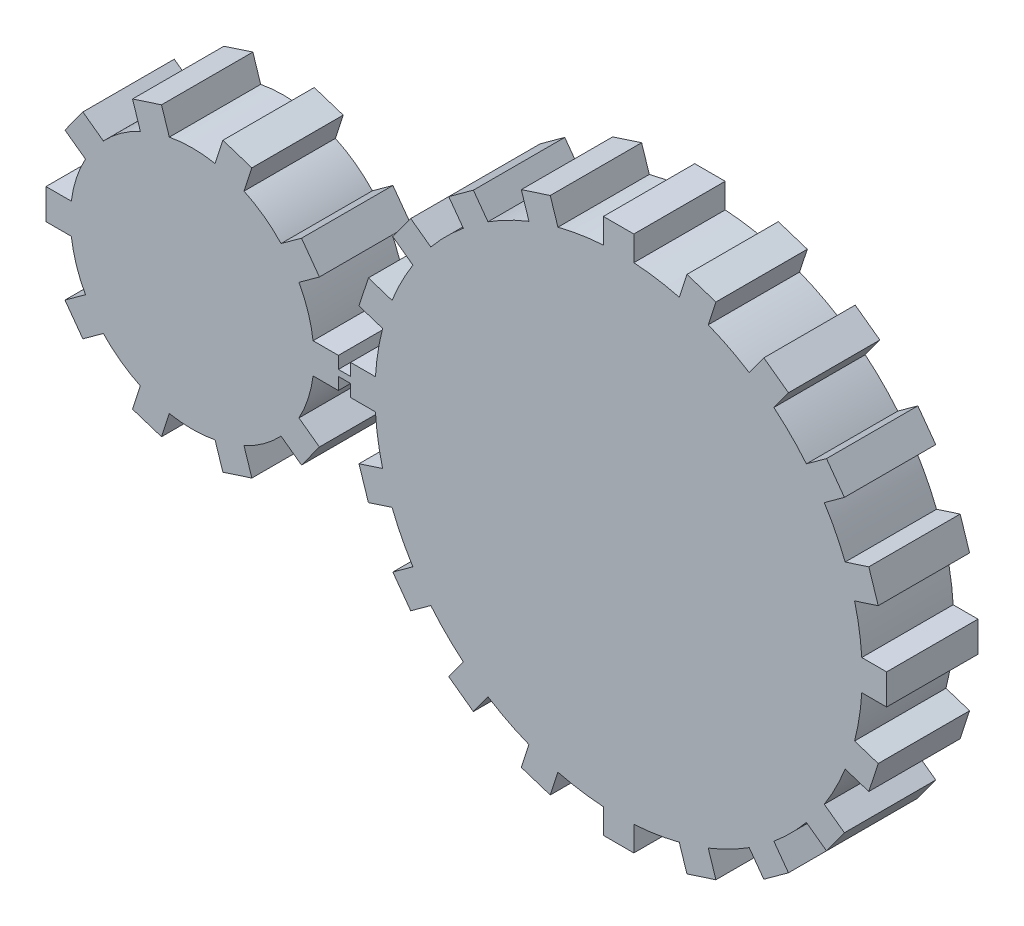
from build123d import *

# Parameters (mm, degrees)
SKETCH_2_R               = 20
EXTRUDE_2_DEPTH          = 15
SKETCH_7_R               = 40
EXTRUDE_4_DEPTH          = 15
SKETCH_9_W               = 5
SKETCH_9_H               = 5
EXTRUDE_6_DEPTH          = 15
PATTERN_CIRCULAR_1_COUNT = 10
SKETCH_17_W              = 5
SKETCH_17_H              = 5
EXTRUDE_9_DEPTH          = 15
PATTERN_CIRCULAR_3_COUNT = 20
SKETCH_18_W              = 3
SKETCH_18_H              = 1
EXTRUDE_10_DEPTH         = 15


with BuildPart() as part:
    # 草图2 → 凸台-拉伸2 (new body)
    with BuildSketch(Plane.XY.offset(-7.5)):
        with Locations((-35, 0)):
            Circle(SKETCH_2_R)
    extrude(amount=EXTRUDE_2_DEPTH)

    # 草图9 → 凸台-拉伸6 (add)
    with BuildSketch(Plane.XY.offset(-7.5)):
        with Locations((-13.5, 0)):
            Rectangle(SKETCH_9_W, SKETCH_9_H)
    extrude_6 = extrude(amount=EXTRUDE_6_DEPTH)

    # 阵列(圆周)1: 凸台-拉伸6 ×10 about axis
    pattern_circular_1_axis = Axis((-35, 0, 8.25), (0, 0, -1))
    for i in range(1, PATTERN_CIRCULAR_1_COUNT):
        add(extrude_6.rotate(pattern_circular_1_axis, i * 360 / PATTERN_CIRCULAR_1_COUNT))



with BuildPart() as body_2:
    # 草图7 → 凸台-拉伸4 (new body)
    with BuildSketch(Plane.XY.offset(-7.5)):
        with Locations((35, 0)):
            Circle(SKETCH_7_R)
    extrude(amount=EXTRUDE_4_DEPTH)

    # 草图17 → 凸台-拉伸9 (add)
    with BuildSketch(Plane.XY.offset(-7.5)):
        with Locations((-6.5, 0)):
            Rectangle(SKETCH_17_W, SKETCH_17_H)
    extrude_9 = extrude(amount=EXTRUDE_9_DEPTH)

    # 阵列(圆周)3: 凸台-拉伸9 ×20 about axis
    pattern_circular_3_axis = Axis((35, 0, 8.25), (0, 0, -1))
    for i in range(1, PATTERN_CIRCULAR_3_COUNT):
        add(extrude_9.rotate(pattern_circular_3_axis, i * 360 / PATTERN_CIRCULAR_3_COUNT))


with BuildPart() as part_1:
    add(part.part)

    add(body_2.part)  # 凸台-拉伸10 merges body 2
    # 草图18 → 凸台-拉伸10 (add)
    with BuildSketch(Plane.XY.offset(-7.5)):
        with Locations((-10, 0)):
            Rectangle(SKETCH_18_W, SKETCH_18_H)
    extrude(amount=EXTRUDE_10_DEPTH)


solid = part_1.part
